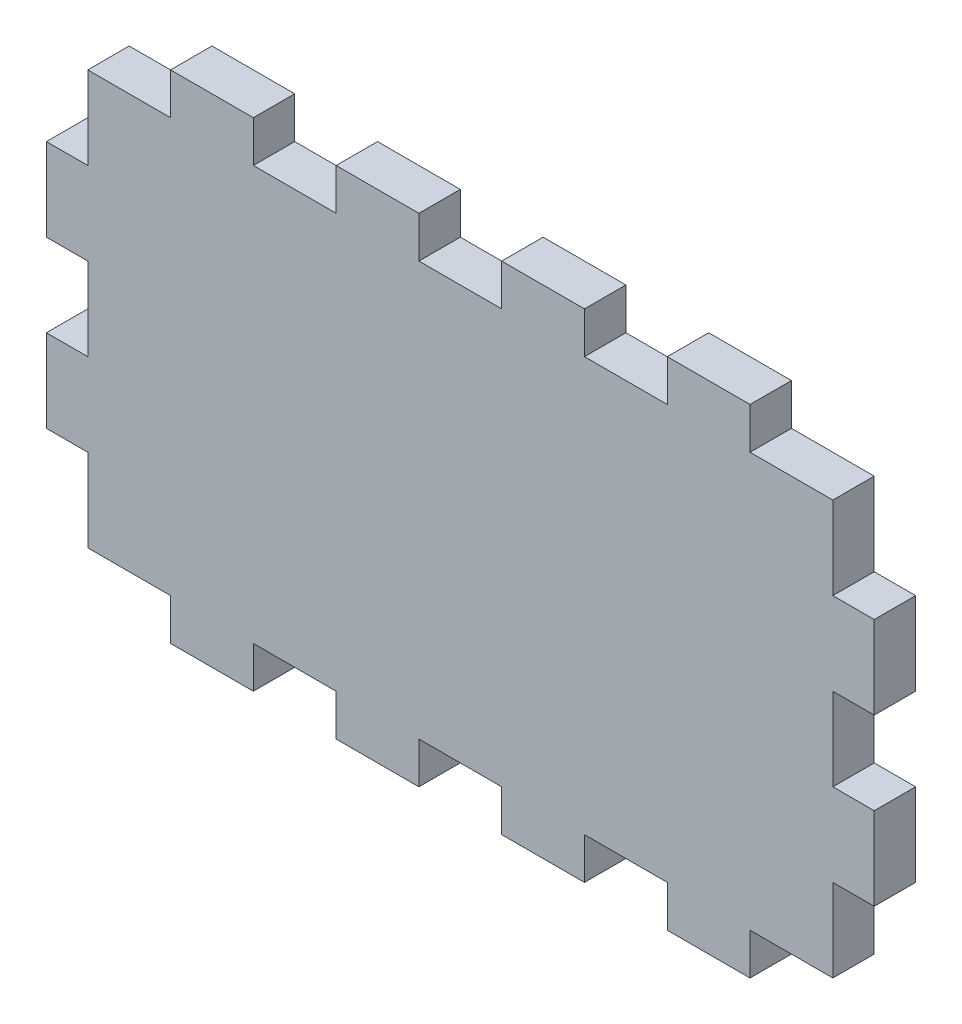
from build123d import *

# Parameters (mm, degrees)
BOSS_EXTRUDE1_DEPTH = 5


with BuildPart() as part:
    # Sketch1 → Boss-Extrude1 (new body)
    with BuildSketch(Plane.XY):
        Polygon((-204.745600738, 156.564771701), (-204.745600738, 146.564771701), (-209.745600738, 146.564771701), (-209.745600738, 136.564771701), (-204.745600738, 136.564771701), (-204.745600738, 126.564771701), (-209.745600738, 126.564771701), (-209.745600738, 116.564771701), (-204.745600738, 116.564771701), (-204.745600738, 106.564771701), (-194.745600738, 106.564771701), (-194.745600738, 101.564771701), (-184.745600738, 101.564771701), (-184.745600738, 106.564771701), (-174.745600738, 106.564771701), (-174.745600738, 101.564771701), (-164.745600738, 101.564771701), (-164.745600738, 106.564771701), (-154.745600738, 106.564771701), (-154.745600738, 101.564771701), (-144.745600738, 101.564771701), (-144.745600738, 106.564771701), (-134.745600738, 106.564771701), (-134.745600738, 101.564771701), (-124.745600738, 101.564771701), (-124.745600738, 106.564771701), (-114.745600738, 106.564771701), (-114.745600738, 116.564771701), (-109.745600738, 116.564771701), (-109.745600738, 126.564771701), (-114.745600738, 126.564771701), (-114.745600738, 136.564771701), (-109.745600738, 136.564771701), (-109.745600738, 146.564771701), (-114.745600738, 146.564771701), (-114.745600738, 156.564771701), (-124.745600738, 156.564771701), (-124.745600738, 161.564771701), (-134.745600738, 161.564771701), (-134.745600738, 156.564771701), (-144.745600738, 156.564771701), (-144.745600738, 161.564771701), (-154.745600738, 161.564771701), (-154.745600738, 156.564771701), (-164.745600738, 156.564771701), (-164.745600738, 161.564771701), (-174.745600738, 161.564771701), (-174.745600738, 156.564771701), (-184.745600738, 156.564771701), (-184.745600738, 161.564771701), (-194.745600738, 161.564771701), (-194.745600738, 156.564771701), align=None)
    extrude(amount=BOSS_EXTRUDE1_DEPTH)


solid = part.part
